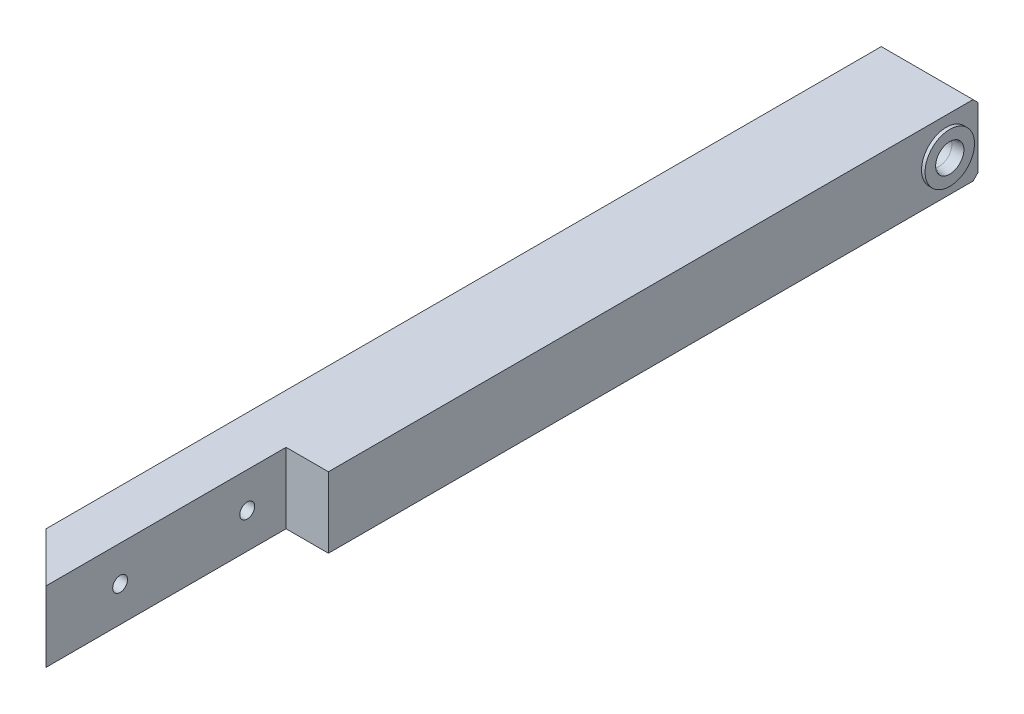
from build123d import *

# Parameters (mm, degrees)
ESQUISSE1_W                         = 13
ESQUISSE1_H                         = 126
BOSS_EXTRU_1_DEPTH                  = 10
ESQUISSE2_W                         = 6
ESQUISSE2_H                         = 34
ENL_V_MAT_EXTRU_1_DEPTH             = 155.389928428
ENL_V_START                         = 1.2
ENL_V_MAT_EXTRU_2_DEPTH             = 0.4
ENL_V_MAT_EXTRU_3_DEPTH             = 0.4
ENL_V_MAT_EXTRU_4_DEPTH             = 0.4
ESQUISSE6_W                         = 0.740791559
ESQUISSE6_H                         = 2.263300419
ENL_V_MAT_EXTRU_5_DEPTH             = 0.4
D_POUILLE1_ANGLE                    = -0.092269995
D_POUILLE2_ANGLE                    = 0.092269995
D_POUILLE3_ANGLE                    = -45
ESQUISSE7_W                         = 0.5
ESQUISSE7_H                         = 3.5
DIAM_TRE_DU_PER_AGE_2_1_2_1_1_D     = 2.1
DIAM_TRE_DU_PER_AGE_2_1_2_1_1_DEPTH = 5
CHANFREIN1_SIZE                     = 0.7


with BuildPart() as part:
    # Esquisse1 → Boss.-Extru.1 (new body)
    with BuildSketch(Plane.XZ.offset(-10)):
        with Locations((21.5, 88.5)):
            Rectangle(ESQUISSE1_W, ESQUISSE1_H)
    extrude(amount=-BOSS_EXTRU_1_DEPTH)

    # Esquisse2 → Enlèv. mat.-Extru.1 (cut, through all)
    with BuildSketch(Plane(origin=(0, 20, 0), x_dir=(-1, 0, 0), z_dir=(0, 1, 0))):
        with Locations((-25, 134.5)):
            Rectangle(ESQUISSE2_W, ESQUISSE2_H)
    extrude(amount=-ENL_V_MAT_EXTRU_1_DEPTH, mode=Mode.SUBTRACT)

    # Esquisse3 → Enlèv. mat.-Extru.2 (cut)
    with BuildSketch(Plane.XZ.offset(-11.2).offset(ENL_V_START)):
        with BuildLine():
            Line((20.853342891, 76.277673701), (21.557298779, 76.278807363))
            Line((21.557298779, 76.278807363), (21.56139183, 73.73719736))
            Line((21.56139183, 73.73719736), (19.337604377, 73.733616136))
            ThreePointArc((19.337604377, 73.733616136), (18.937851016, 74.311477162), (18.633015037, 74.944565734))
            add(Edge.make_bspline(
                [(18.633015037, 74.944565734), (18.598877989, 75.048134715), (18.530815128, 75.254631808), (18.449647927, 75.570941889), (18.41259048, 75.895390829), (18.402660702, 76.11257772), (18.397680402, 76.221508226)],
                knots=[0, 0, 0, 0, 0.250783, 0.500014197, 0.749231153, 1, 1, 1, 1], degree=3))
            add(Edge.make_bspline(
                [(18.397680402, 76.221508226), (18.404707316, 76.360829639), (18.418683348, 76.637930028), (18.475840729, 77.051065085), (18.608033081, 77.446634686), (18.719977562, 77.700354542), (18.776261687, 77.827921352)],
                knots=[0, 0, 0, 0, 0.251459099, 0.500134278, 0.748674478, 1, 1, 1, 1], degree=3))
            add(Edge.make_bspline(
                [(18.776261687, 77.827921352), (18.845594133, 77.939975948), (18.983004533, 78.16205764), (19.226428261, 78.470943979), (19.536080689, 78.713393436), (19.758734474, 78.849811508), (19.871078014, 78.918643436)],
                knots=[0, 0, 0, 0, 0.252300142, 0.500035199, 0.747734736, 1, 1, 1, 1], degree=3))
            add(Edge.make_bspline(
                [(19.871078014, 78.918643436), (19.998387452, 78.973593805), (20.251642055, 79.082905685), (20.645993091, 79.211619983), (21.057113166, 79.266914711), (21.332777469, 79.280276264), (21.471351266, 79.286992988)],
                knots=[0, 0, 0, 0, 0.251271452, 0.499850228, 0.748579513, 1, 1, 1, 1], degree=3))
            add(Edge.make_bspline(
                [(21.471351266, 79.286992988), (21.61250902, 79.279773241), (21.893469007, 79.265403078), (22.312514038, 79.209031831), (22.7157204, 79.081743941), (22.975763595, 78.974547289), (23.106412768, 78.920690259)],
                knots=[0, 0, 0, 0, 0.251233762, 0.500054957, 0.748820933, 1, 1, 1, 1], degree=3))
            add(Edge.make_bspline(
                [(23.106412768, 78.920690259), (23.221187424, 78.855887896), (23.448551437, 78.727517), (23.766911077, 78.49685491), (24.019672726, 78.19573618), (24.162080848, 77.977148745), (24.233970523, 77.866802654)],
                knots=[0, 0, 0, 0, 0.252519074, 0.500230209, 0.747708999, 1, 1, 1, 1], degree=3))
            add(Edge.make_bspline(
                [(24.233970523, 77.866802654), (24.289601824, 77.74114466), (24.400227282, 77.491267832), (24.529493504, 77.101027909), (24.583614751, 76.693519205), (24.596060717, 76.420296572), (24.602319479, 76.282899818)],
                knots=[0, 0, 0, 0, 0.251319556, 0.499760752, 0.748442329, 1, 1, 1, 1], degree=3))
            add(Edge.make_bspline(
                [(24.602319479, 76.282899818), (24.598711263, 76.182464999), (24.591519454, 75.982280772), (24.56051168, 75.683056166), (24.48684006, 75.391387004), (24.423380488, 75.201497819), (24.391541958, 75.106227836)],
                knots=[0, 0, 0, 0, 0.250925915, 0.500139405, 0.749213149, 1, 1, 1, 1], degree=3))
            add(Edge.make_bspline(
                [(24.391541958, 75.106227836), (24.356062424, 75.028126494), (24.285554136, 74.87291611), (24.15898731, 74.650089551), (23.991023414, 74.45654053), (23.86675947, 74.34011923), (23.804229379, 74.281535587)],
                knots=[0, 0, 0, 0, 0.25175747, 0.500316288, 0.748557245, 1, 1, 1, 1], degree=3))
            add(Edge.make_bspline(
                [(23.804229379, 74.281535587), (23.728753924, 74.230590324), (23.578415746, 74.129113387), (23.340086032, 73.996604052), (23.084028963, 73.902840483), (22.909556406, 73.852507456), (22.821965098, 73.827238521)],
                knots=[0, 0, 0, 0, 0.250860638, 0.499684722, 0.748824286, 1, 1, 1, 1], degree=3))
            Line((22.821965098, 73.827238521), (22.625511765, 74.543474159))
            add(Edge.make_bspline(
                [(22.625511765, 74.543474159), (22.689177507, 74.563582686), (22.816125851, 74.603678729), (23.002808274, 74.674933967), (23.178371642, 74.770364118), (23.289904539, 74.84276967), (23.345839262, 74.879081687)],
                knots=[0, 0, 0, 0, 0.250917255, 0.500324495, 0.749408362, 1, 1, 1, 1], degree=3))
            add(Edge.make_bspline(
                [(23.345839262, 74.879081687), (23.390203046, 74.919598808), (23.478372835, 75.000123634), (23.597726044, 75.134487648), (23.688549595, 75.289563684), (23.73964112, 75.397672698), (23.765348077, 75.45206829)],
                knots=[0, 0, 0, 0, 0.251387332, 0.499614011, 0.748228283, 1, 1, 1, 1], degree=3))
            add(Edge.make_bspline(
                [(23.765348077, 75.45206829), (23.789008491, 75.518784077), (23.836150518, 75.651711479), (23.891167257, 75.856395572), (23.914580183, 76.067045865), (23.920133119, 76.208042107), (23.922920108, 76.278807363)],
                knots=[0, 0, 0, 0, 0.250882944, 0.49986997, 0.748987428, 1, 1, 1, 1], degree=3))
            add(Edge.make_bspline(
                [(23.922920108, 76.278807363), (23.920511452, 76.359188387), (23.915711583, 76.519368292), (23.89240824, 76.758868036), (23.834062357, 76.992322036), (23.782857942, 77.144019816), (23.757162571, 77.22014471)],
                knots=[0, 0, 0, 0, 0.251034583, 0.500251096, 0.74921629, 1, 1, 1, 1], degree=3))
            add(Edge.make_bspline(
                [(23.757162571, 77.22014471), (23.729672868, 77.279418984), (23.674945132, 77.397424872), (23.579353438, 77.56786432), (23.456707319, 77.720003547), (23.366562662, 77.813633023), (23.321282744, 77.860663375)],
                knots=[0, 0, 0, 0, 0.25126472, 0.500229098, 0.748963655, 1, 1, 1, 1], degree=3))
            add(Edge.make_bspline(
                [(23.321282744, 77.860663375), (23.275908475, 77.898471307), (23.185404712, 77.973883213), (23.042714988, 78.078444046), (22.887828988, 78.163906132), (22.781260082, 78.214085774), (22.727831483, 78.239243469)],
                knots=[0, 0, 0, 0, 0.250690915, 0.500029454, 0.749338462, 1, 1, 1, 1], degree=3))
            add(Edge.make_bspline(
                [(22.727831483, 78.239243469), (22.630282244, 78.273310635), (22.435887582, 78.341199173), (22.136961191, 78.420956742), (21.82952565, 78.455607579), (21.623732954, 78.464151438), (21.520464301, 78.468438825)],
                knots=[0, 0, 0, 0, 0.250863433, 0.499916891, 0.749053732, 1, 1, 1, 1], degree=3))
            add(Edge.make_bspline(
                [(21.520464301, 78.468438825), (21.404727069, 78.464782543), (21.17444342, 78.457507597), (20.830459066, 78.41956085), (20.498481034, 78.321775426), (20.285218981, 78.235525632), (20.178035378, 78.192177257)],
                knots=[0, 0, 0, 0, 0.251508131, 0.500428504, 0.748919829, 1, 1, 1, 1], degree=3))
            add(Edge.make_bspline(
                [(20.178035378, 78.192177257), (20.095012391, 78.141920052), (19.930593774, 78.042390751), (19.702109128, 77.864604869), (19.524573648, 77.635924233), (19.425752299, 77.47115107), (19.375852227, 77.387948474)],
                knots=[0, 0, 0, 0, 0.252519428, 0.500089146, 0.747568839, 1, 1, 1, 1], degree=3))
            add(Edge.make_bspline(
                [(19.375852227, 77.387948474), (19.337663327, 77.298574803), (19.261671031, 77.120729659), (19.170871606, 76.844534828), (19.129994348, 76.556685787), (19.119293569, 76.36357432), (19.113916039, 76.266528806)],
                knots=[0, 0, 0, 0, 0.251262992, 0.499989565, 0.748726625, 1, 1, 1, 1], degree=3))
            add(Edge.make_bspline(
                [(19.113916039, 76.266528806), (19.118173223, 76.18036823), (19.126657842, 76.008649142), (19.158071405, 75.752276351), (19.226503664, 75.503216877), (19.283711047, 75.341066696), (19.312415004, 75.259707412)],
                knots=[0, 0, 0, 0, 0.250862607, 0.499972264, 0.749109753, 1, 1, 1, 1], degree=3))
            add(Edge.make_bspline(
                [(19.312415004, 75.259707412), (19.340302347, 75.193424583), (19.3959353, 75.061195796), (19.489793739, 74.867464161), (19.606433607, 74.686525861), (19.692748901, 74.572154479), (19.736016273, 74.514823398)],
                knots=[0, 0, 0, 0, 0.250800542, 0.500326436, 0.749528026, 1, 1, 1, 1], degree=3))
            Line((19.736016273, 74.514823398), (20.853342891, 74.514823398))
            Line((20.853342891, 74.514823398), (20.853342891, 76.277673701))
        make_face()
    extrude(amount=-ENL_V_MAT_EXTRU_2_DEPTH, mode=Mode.SUBTRACT)

    # Esquisse4 → Enlèv. mat.-Extru.3 (cut)
    with BuildSketch(Plane.XZ.offset(-10)):
        Polygon((24.500000358, 84.16557475), (18.500000119, 84.16557475), (18.500000119, 83.371577701), (21.225784898, 83.371577701), (21.225784898, 80.555751762), (21.933833838, 80.555751762), (21.933833838, 83.371577701), (23.791950822, 83.371577701), (23.791950822, 80.117825708), (24.500000358, 80.117825708), align=None)
    extrude(amount=-ENL_V_MAT_EXTRU_3_DEPTH, mode=Mode.SUBTRACT)

    # Esquisse5 → Enlèv. mat.-Extru.4 (cut)
    with BuildSketch(Plane.XZ.offset(-10)):
        Polygon((24.500000358, 69.734468898), (18.500000119, 69.734468898), (18.500000119, 68.940470657), (21.225784898, 68.940470657), (21.225784898, 66.124647102), (21.933833838, 66.124647102), (21.933833838, 68.940470657), (23.791950822, 68.940470657), (23.791950822, 65.686719856), (24.500000358, 65.686719856), align=None)
    extrude(amount=-ENL_V_MAT_EXTRU_4_DEPTH, mode=Mode.SUBTRACT)

    # Esquisse6 → Enlèv. mat.-Extru.5 (cut)
    with BuildSketch(Plane.XZ.offset(-10)):
        with Locations((20.671214343, 71.815642556)):
            Rectangle(ESQUISSE6_W, ESQUISSE6_H)
    extrude(amount=-ENL_V_MAT_EXTRU_5_DEPTH, mode=Mode.SUBTRACT)

    # Dépouille1
    d_pouille1_faces = [part.faces().sort_by_distance(p)[0] for p in [
        (20.449498104, 10.2, 73.735406748),
    ]]
    draft(d_pouille1_faces, Plane(origin=(21.680083212, 10.4, 0.034913966), x_dir=(0.0016104145188022617, 0, -0.9999987032816982), z_dir=(-0.9999987032816982, 0, -0.0016104145188022617)), D_POUILLE1_ANGLE)

    # Dépouille2
    d_pouille2_faces = [part.faces().sort_by_distance(p)[0] for p in [
        (21.205320835, 10.2, 76.278240532),
    ]]
    draft(d_pouille2_faces, Plane(origin=(21.680083212, 10.4, 0.034913966), x_dir=(0.0016104145188022617, 0, -0.9999987032816982), z_dir=(-0.9999987032816982, 0, -0.0016104145188022617)), D_POUILLE2_ANGLE)

    # Dépouille3
    d_pouille3_faces = [part.faces().sort_by_distance(p)[0] for p in [
        (18.5, 15, 151.5),
    ]]
    draft(d_pouille3_faces, Plane(origin=(22, 10, 117.5), x_dir=(0, 0, 1), z_dir=(1, 0, 0)), D_POUILLE3_ANGLE)

    # Esquisse7 → Révolution1 (revolve)
    with BuildSketch(Plane.XY.offset(30.000000447), mode=Mode.PRIVATE) as r_volution1_sk:
        with Locations((28.25, 16.750000224)):
            Rectangle(ESQUISSE7_W, ESQUISSE7_H)
    revolve(r_volution1_sk.sketch.rotate(Axis((28, 15.000000224, 30.000000447), (1, 0, 0)), 270), axis=Axis((28, 15.000000224, 30.000000447), (1, 0, 0)))

    # Esquisse8 → Fraisage pour vis à tête fraisée M31 (revolve, cut)
    with BuildSketch(Plane(origin=(28.5, 15.000000224, 30.000000447), x_dir=(0, 0, -1), z_dir=(0, 1, 0))):
        Polygon((0, 0), (0, 7), (1.8, 7), (1.8, 1.5), (2, 0), align=None)
    revolve(axis=Axis((34.85, 15.000000224, 30.000000447), (-1, 0, 0)), mode=Mode.SUBTRACT)

    # Diamètre du perçage Ø2.1 (2.1)1
    with Locations(Plane(origin=(22, 0, 0), x_dir=(0, 0, -1), z_dir=(1, 0, 0))):
        with Locations((-141.000001952, 15.000000224), (-123.000001684, 15.000000224)):
            Hole(DIAM_TRE_DU_PER_AGE_2_1_2_1_1_D / 2, depth=DIAM_TRE_DU_PER_AGE_2_1_2_1_1_DEPTH)

    # Chanfrein1
    chanfrein1_edges = [part.edges().sort_by_distance(p)[0] for p in [
        (21.5, 20, 25.5),
        (21.5, 10, 25.5),
    ]]
    chamfer(chanfrein1_edges, length=CHANFREIN1_SIZE)


solid = part.part
